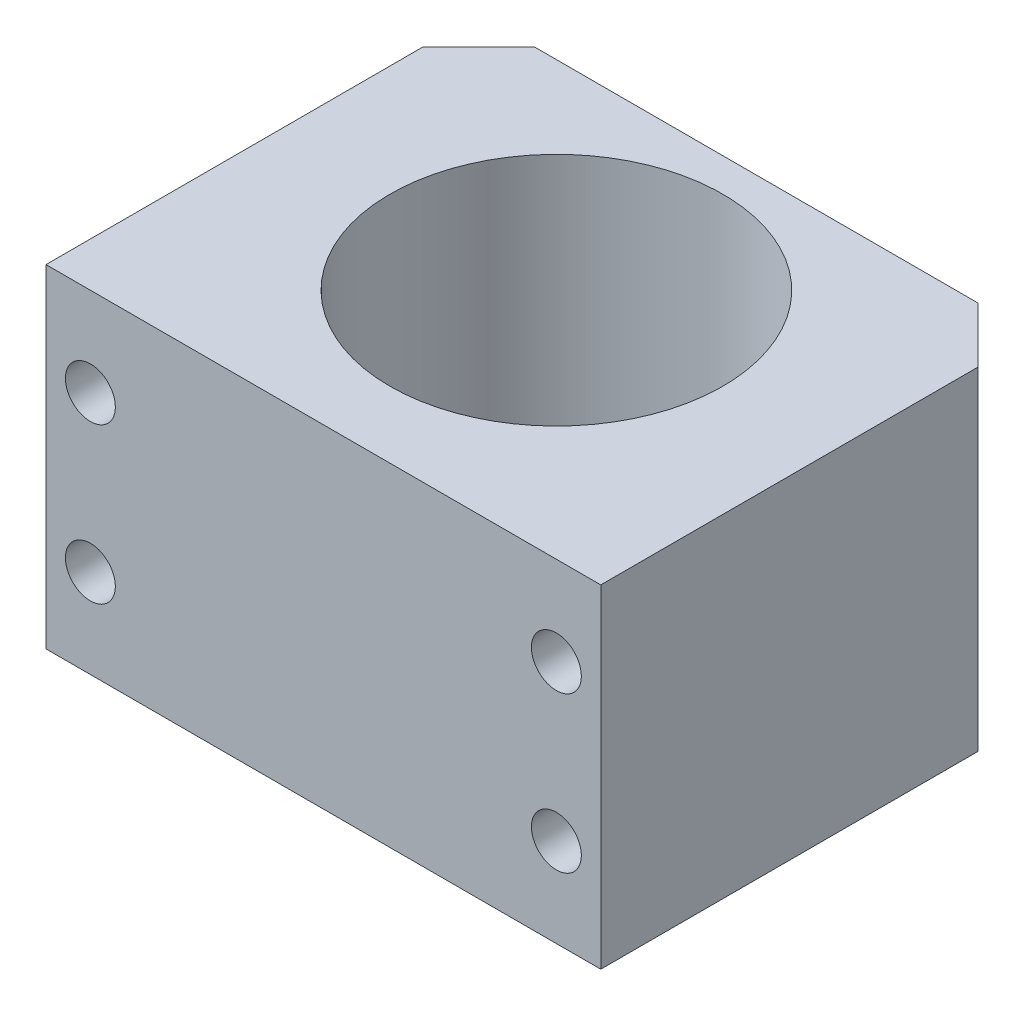
from build123d import *

# Parameters (mm, degrees)
SKETCH_1_W             = 50
SKETCH_1_H             = 39
EXTRUDE_1_DEPTH        = 30
SKETCH_2_R             = 15
CUT_EXTRUDE_1_DEPTH    = 30
CHAMFER_1_SIZE         = 5
HOLE_WIZARD_M4_1_D     = 4.5
HOLE_WIZARD_M4_1_DEPTH = 20
HOLE_WIZARD_M4_1_TIP   = 1.351936393


with BuildPart() as part:
    # 스케치1 → 보스-돌출1 (new body)
    with BuildSketch(Plane(origin=(0, 0, 0), x_dir=(1, 0, 0), z_dir=(0, 1, 0))):
        Rectangle(SKETCH_1_W, SKETCH_1_H)
    extrude(amount=EXTRUDE_1_DEPTH)

    # 스케치2 → 컷-돌출1 (cut)
    with BuildSketch(Plane(origin=(0, 30, 0), x_dir=(1, 0, 0), z_dir=(0, 1, 0))):
        with Locations(Location((0, 1.5, 0), (0, 0, 270))):
            Circle(SKETCH_2_R)
    extrude(amount=-CUT_EXTRUDE_1_DEPTH, mode=Mode.SUBTRACT)

    # 모따기1
    chamfer_1_edges = [part.edges().sort_by_distance(p)[0] for p in [
        (-25, 15, -19.5),
        (25, 15, -19.5),
    ]]
    chamfer(chamfer_1_edges, length=CHAMFER_1_SIZE)

    # M4 여유 구멍1
    with Locations(Plane.XY.offset(19.5)):
        with Locations((-21, 22), (21, 22), (21, 8), (-21, 8)):
            Hole(HOLE_WIZARD_M4_1_D / 2, depth=HOLE_WIZARD_M4_1_DEPTH)
            with Locations((0, 0, -(HOLE_WIZARD_M4_1_DEPTH + HOLE_WIZARD_M4_1_TIP / 2))):  # 118° drill point
                Cone(0, HOLE_WIZARD_M4_1_D / 2, HOLE_WIZARD_M4_1_TIP, mode=Mode.SUBTRACT)


solid = part.part
